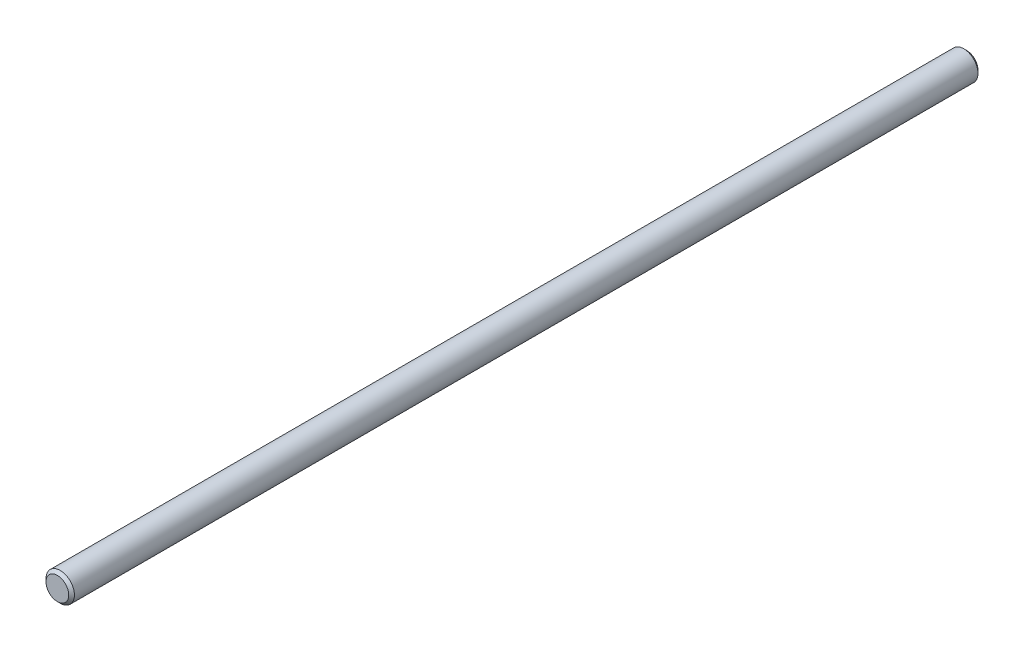
from build123d import *

# Parameters (mm, degrees)
SKETCH3_R           = 4.7625
BOSS_EXTRUDE1_DEPTH = 152.4
CHAMFER1_SIZE       = 0.9525


with BuildPart() as part:
    # Sketch3 → Boss-Extrude1 (new, symmetric)
    with BuildSketch(Plane.XY):
        with Locations(Location((0, 0, 0), (0, 0, 180))):
            Circle(SKETCH3_R)
    extrude(amount=BOSS_EXTRUDE1_DEPTH, both=True)

    # Chamfer1
    chamfer1_edges = [part.edges().sort_by_distance(p)[0] for p in [
        (4.7625, 0, -152.4),
        (4.7625, 0, 152.4),
    ]]
    chamfer(chamfer1_edges, length=CHAMFER1_SIZE)


solid = part.part
